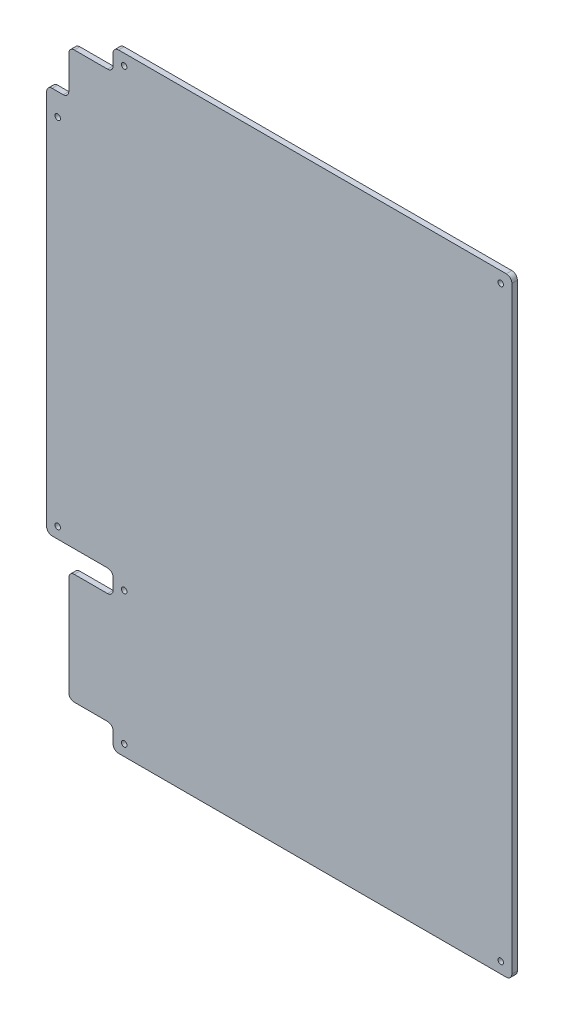
from build123d import *

# Parameters (mm, degrees)
SKETCH_1_W          = 420
SKETCH_1_H          = 550
EXTRUDE_1_DEPTH     = 5
SKETCH_2_R          = 2.5
CUT_EXTRUDE_1_DEPTH = 15
FILLET_1_R          = 5


with BuildPart() as part:
    # 草图1 → 凸台-拉伸1 (new body)
    with BuildSketch(Plane.XY):
        Rectangle(SKETCH_1_W, SKETCH_1_H)
    extrude(amount=EXTRUDE_1_DEPTH)

    # 草图2 → 切除-拉伸1 (cut)
    with BuildSketch(Plane.XY.offset(5)):
        with Locations((-200, 195)):
            Circle(SKETCH_2_R)
        with Locations((-140, 265)):
            Circle(SKETCH_2_R)
        with Locations((-140, -265)):
            Circle(SKETCH_2_R)
        with Locations((-140, -145)):
            Circle(SKETCH_2_R)
        with Locations((-200, -125)):
            Circle(SKETCH_2_R)
        with Locations((200, 265)):
            Circle(SKETCH_2_R)
        with Locations((200, -265)):
            Circle(SKETCH_2_R)
        Polygon((-190, 255), (-190, 215), (-210, 215), (-210, 275), (-150, 275), (-150, 255), align=None)
        Polygon((-190, -255), (-150, -255), (-150, -275), (-210, -275), (-210, -135), (-150, -135), (-150, -155), (-190, -155), align=None)
    extrude(amount=-CUT_EXTRUDE_1_DEPTH, mode=Mode.SUBTRACT)

    # 圆角1
    fillet_1_edges = [part.edges().sort_by_distance(p)[0] for p in [
        (-210, -135, 2.5),
        (-150, -135, 2.5),
        (-150, -155, 2.5),
        (-190, -155, 2.5),
        (-190, -255, 2.5),
        (-150, -255, 2.5),
        (-150, -275, 2.5),
        (-150, 275, 2.5),
        (-150, 255, 2.5),
        (-190, 255, 2.5),
        (-190, 215, 2.5),
        (-210, 215, 2.5),
        (210, -275, 2.5),
        (210, 275, 2.5),
    ]]
    fillet(fillet_1_edges, radius=FILLET_1_R)


solid = part.part
